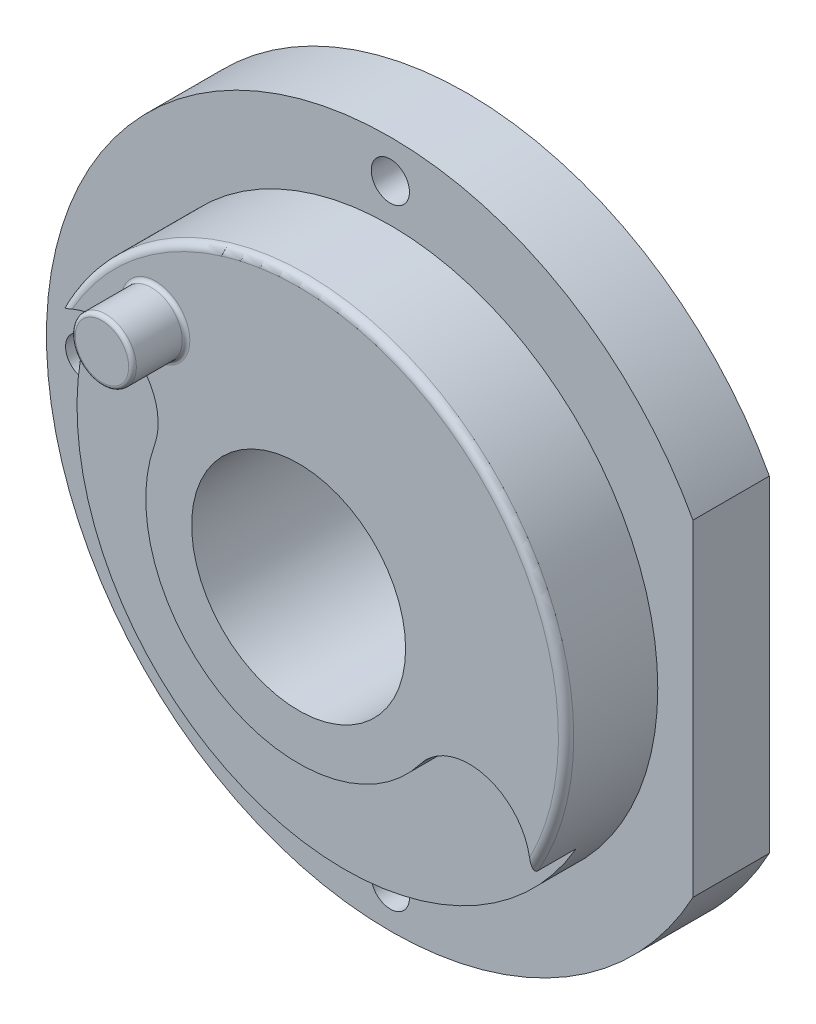
from build123d import *

# Parameters (mm, degrees)
SKETCH_1_R          = 22.5
SKETCH_1_R_2        = 1.25
EXTRUDE_1_DEPTH     = 5
SKETCH_2_R          = 17.5
EXTRUDE_2_DEPTH     = 6
SKETCH_3_R          = 2
EXTRUDE_3_DEPTH     = 3.5
FILLET_1_R          = 0.5
FILLET_2_R          = 0.25
CUT_EXTRUDE_1_DEPTH = 3
SKETCH_5_R          = 7
CUT_EXTRUDE_2_DEPTH = 11
SKETCH_6_W          = 10.283159463
SKETCH_6_H          = 33.988548121
CUT_EXTRUDE_3_DEPTH = 17


with BuildPart() as part:
    # 草图1 → 凸台-拉伸1 (new body)
    with BuildSketch(Plane.XY):
        Circle(SKETCH_1_R)
        with Locations((0, 20)):
            Circle(SKETCH_1_R_2, mode=Mode.SUBTRACT)
        with Locations((0, -20)):
            Circle(SKETCH_1_R_2, mode=Mode.SUBTRACT)
        with Locations((-20, 0)):
            Circle(SKETCH_1_R_2, mode=Mode.SUBTRACT)
    extrude(amount=EXTRUDE_1_DEPTH)

    # 草图2 → 凸台-拉伸2 (add)
    with BuildSketch(Plane.XY.offset(5)):
        Circle(SKETCH_2_R)
    extrude(amount=EXTRUDE_2_DEPTH)

    # 草图3 → 凸台-拉伸3 (add)
    with BuildSketch(Plane.XY.offset(11)):
        with Locations((-9.367828489, 10.404027557)):
            Circle(SKETCH_3_R)
    extrude(amount=EXTRUDE_3_DEPTH)

    # 圆角1
    fillet_1_edges = [part.edges().sort_by_distance(p)[0] for p in [
        (-17.5, 0, 11),
    ]]
    fillet(fillet_1_edges, radius=FILLET_1_R)

    # 圆角2
    fillet_2_edges = [part.edges().sort_by_distance(p)[0] for p in [
        (-11.367828489, 10.404027557, 11),
        (-11.367828489, 10.404027557, 14.5),
    ]]
    fillet(fillet_2_edges, radius=FILLET_2_R)

    # 草图4 → 切除-拉伸1 (cut)
    with BuildSketch(Plane.XY.offset(11)):
        with BuildLine():
            ThreePointArc((-16.962482908, 6.022804462), (-8.539705078, -15.845297005), (14.357267915, -10.856742514))
            ThreePointArc((14.357267915, -10.856742514), (13.579373382, -5.253629085), (7.976259953, -6.031523619))
            ThreePointArc((7.976259953, -6.031523619), (-4.744280599, -8.802942781), (-9.423601616, 3.346002479))
            ThreePointArc((-9.423601616, 3.346002479), (-11.85464127, 8.453844117), (-16.962482908, 6.022804462))
        make_face()
    extrude(amount=-CUT_EXTRUDE_1_DEPTH, mode=Mode.SUBTRACT)

    # 草图5 → 切除-拉伸2 (cut)
    with BuildSketch(Plane.XY.offset(11)):
        Circle(SKETCH_5_R)
    extrude(amount=-CUT_EXTRUDE_2_DEPTH, mode=Mode.SUBTRACT)

    # 草图6 → 切除-拉伸3 (cut)
    with BuildSketch(Plane.XY.offset(5)):
        with Locations((24.941579731, -0.947133109)):
            Rectangle(SKETCH_6_W, SKETCH_6_H)
    extrude(amount=-CUT_EXTRUDE_3_DEPTH, mode=Mode.SUBTRACT)


solid = part.part
